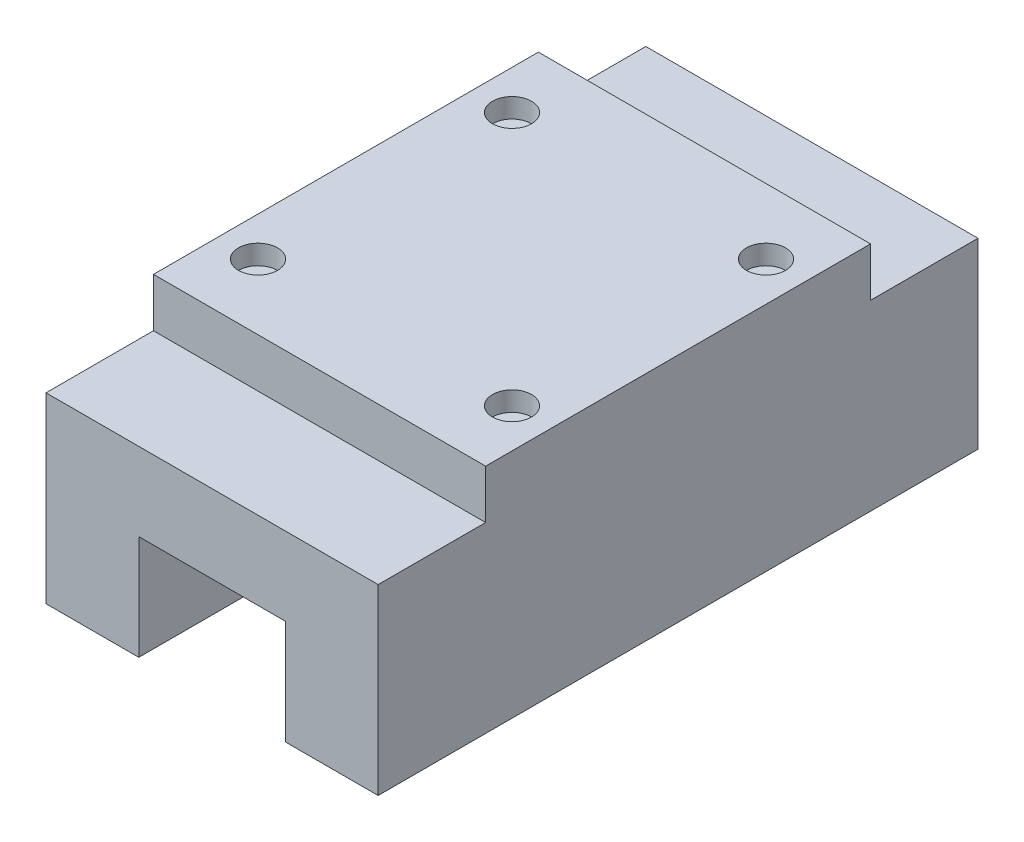
from build123d import *

# Parameters (mm, degrees)
EXTRUDE_1_DEPTH     = 61.4
SKETCH_2_W          = 17.963644186
SKETCH_2_H          = 5.547595999
SKETCH_2_W_2        = 22.810435624
SKETCH_2_H_2        = 6.55669033
CUT_EXTRUDE_1_DEPTH = 61.4
SKETCH_3_R          = 2
CUT_EXTRUDE_2_DEPTH = 2


with BuildPart() as part:
    # Эскиз1 → Вытянуть1 (new body)
    with BuildSketch(Plane.XY):
        Polygon((24.5, 0), (34, 0), (34, 23.7), (0, 23.7), (0, 0), (9.5, 0), (9.5, 10.7), (24.5, 10.7), align=None)
    extrude(amount=EXTRUDE_1_DEPTH)

    # Эскиз2 → Вырез-Вытянуть1 (cut)
    with BuildSketch(Plane(origin=(34, 0, 0), x_dir=(0, 0, -1), z_dir=(1, 0, 0))):
        with Locations((-59.381822093, 21.473798)):
            Rectangle(SKETCH_2_W, SKETCH_2_H)
        with Locations((0.405217812, 21.978345165)):
            Rectangle(SKETCH_2_W_2, SKETCH_2_H_2)
    extrude(amount=-CUT_EXTRUDE_1_DEPTH, mode=Mode.SUBTRACT)

    # Эскиз3 → Вырез-Вытянуть2 (cut)
    with BuildSketch(Plane(origin=(0, 23.7, 0), x_dir=(-1, 0, 0), z_dir=(0, 1, 0))):
        with Locations(Location((-4.0002, 17.6999, 0), (0, 0, 90))):
            Circle(SKETCH_3_R)
        with Locations(Location((-30.0002, 17.6999, 0), (0, 0, 90))):
            Circle(SKETCH_3_R)
        with Locations(Location((-4.0002, 43.6999, 0), (0, 0, 90))):
            Circle(SKETCH_3_R)
        with Locations(Location((-30.0002, 43.6999, 0), (0, 0, 90))):
            Circle(SKETCH_3_R)
    extrude(amount=-CUT_EXTRUDE_2_DEPTH, mode=Mode.SUBTRACT)


solid = part.part
